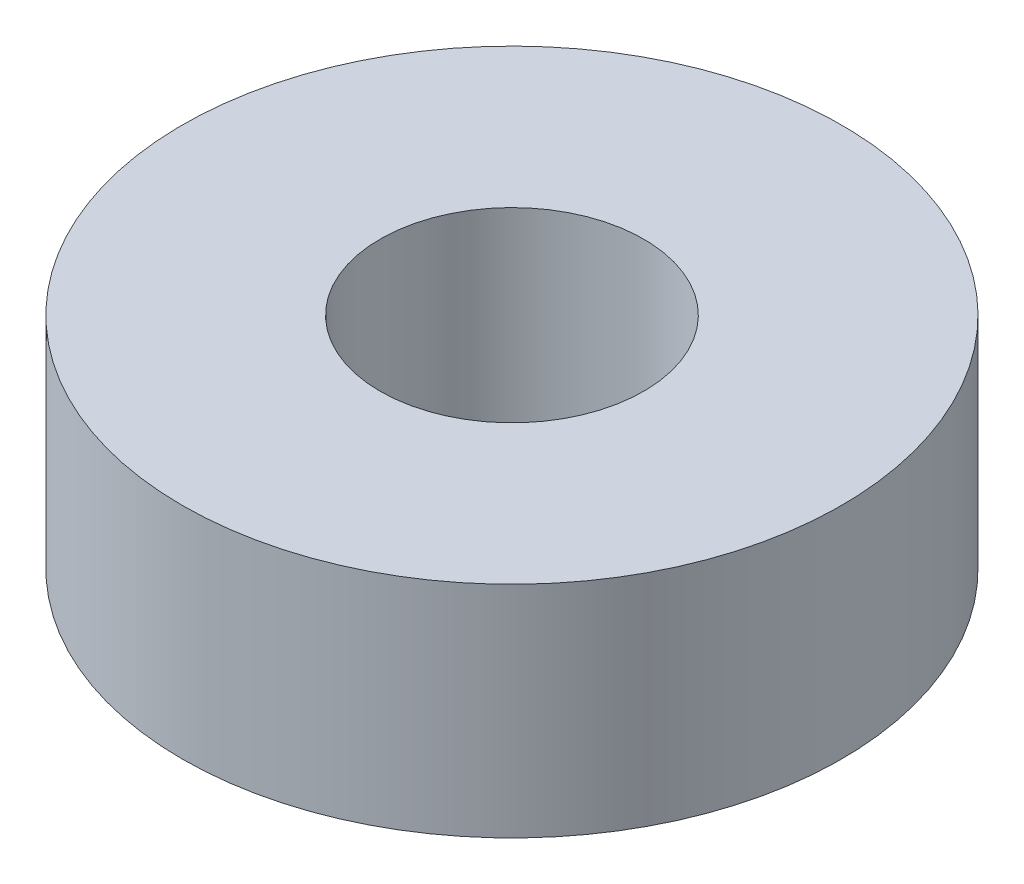
from build123d import *

# Parameters (mm, degrees)
SKETCH1_R           = 7.5
SKETCH1_R_2         = 3
BOSS_EXTRUDE1_DEPTH = 5


with BuildPart() as part:
    # Sketch1 → Boss-Extrude1 (new body)
    with BuildSketch(Plane(origin=(0, 0, 0), x_dir=(1, 0, 0), z_dir=(0, 1, 0))):
        with Locations(Location((0, 0, 0), (0, 0, 270))):
            Circle(SKETCH1_R)
        with Locations(Location((0, 0, 0), (0, 0, 270))):
            Circle(SKETCH1_R_2, mode=Mode.SUBTRACT)
    extrude(amount=BOSS_EXTRUDE1_DEPTH)


solid = part.part
